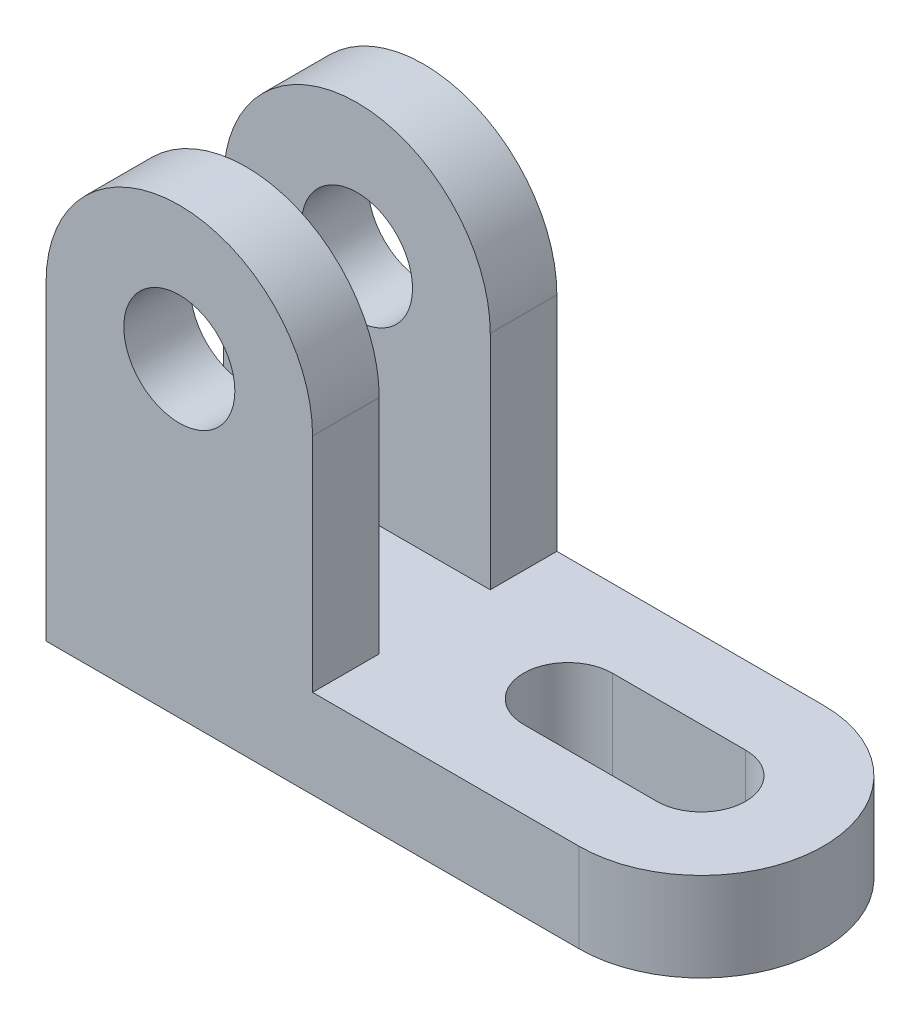
from build123d import *

# Parameters (mm, degrees)
SKETCH1_R           = 22
BOSS_EXTRUDE1_DEPTH = 16
CUT_EXTRUDE2_DEPTH  = 16
BOSS_EXTRUDE2_DEPTH = 12


with BuildPart() as part:
    # Sketch1 → Boss-Extrude1 (new body)
    with BuildSketch(Plane(origin=(0, 0, 0), x_dir=(1, 0, 0), z_dir=(0, 1, 0))):
        with BuildLine():
            Line((37.000000064, 22), (-59, 22))
            Line((-59, 22), (-59, -22))
            Line((-59, -22), (37, -22))
            ThreePointArc((37, -22), (15, 3.2e-08), (37.000000064, 22))
        make_face()
        with Locations((37, 0)):
            Circle(SKETCH1_R)
    extrude(amount=BOSS_EXTRUDE1_DEPTH)

    # Sketch5 → Cut-Extrude2 (cut)
    with BuildSketch(Plane(origin=(0, 16, 0), x_dir=(1, 0, 0), z_dir=(0, 1, 0))):
        with BuildLine():
            Line((37, -8), (13, -8))
            ThreePointArc((13, -8), (5, 0), (13, 8))
            Line((13, 8), (37, 8))
            ThreePointArc((37, 8), (45, 0), (37, -8))
        make_face()
    extrude(amount=-CUT_EXTRUDE2_DEPTH, mode=Mode.SUBTRACT)

    # Sketch6 → Boss-Extrude2 (add)
    with BuildSketch(Plane.XY.offset(22)):
        with BuildLine():
            Line((-59, 56), (-59, 16))
            Line((-59, 16), (-11, 16))
            Line((-11, 16), (-11, 56))
            ThreePointArc((-11, 56), (-35, 32), (-59, 56))
        make_face()
        with BuildLine():
            ThreePointArc((-11, 56), (-35, 80), (-59, 56))
            Line((-59, 56), (-45, 56))
            ThreePointArc((-45, 56), (-35, 66), (-25, 56))
            Line((-25, 56), (-11, 56))
        make_face()
        with BuildLine():
            Line((-45, 56), (-59, 56))
            ThreePointArc((-59, 56), (-35, 32), (-11, 56))
            Line((-11, 56), (-25, 56))
            ThreePointArc((-25, 56), (-35, 46), (-45, 56))
        make_face()
    boss_extrude2 = extrude(amount=-BOSS_EXTRUDE2_DEPTH)

    # Mirror1: Boss-Extrude2 across plane
    add(boss_extrude2.mirror(Plane.XY))


solid = part.part
